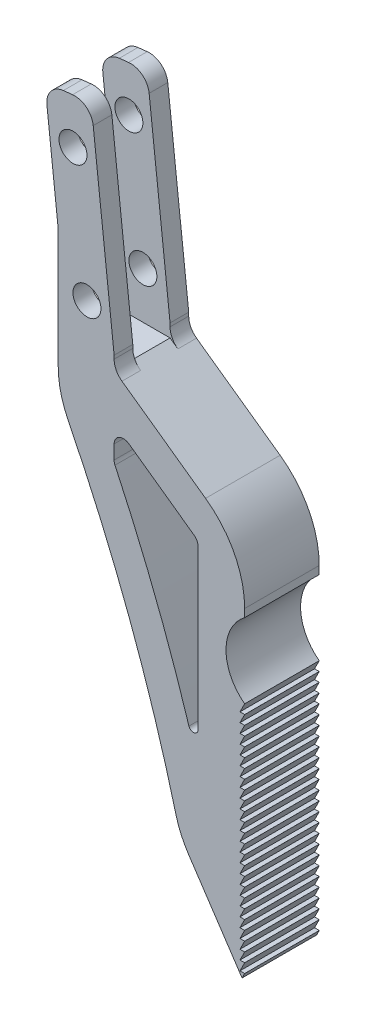
from build123d import *

# Parameters (mm, degrees)
BOSS_EXTRUDE1_DEPTH     = 4
SKETCH3_W               = 20
SKETCH3_H               = 25
CUT_EXTRUDE1_DEPTH      = 2
CUT_EXTRUDE2_DEPTH      = 78.081938119
CUT_EXTRUDE2_DEPTH_BACK = 78.081938119
CUT_EXTRUDE3_DEPTH      = 78.081938119
LPATTERN1_COUNT         = 26
LPATTERN1_PITCH         = 1.0025
CUT_EXTRUDE4_DEPTH      = 78.081938119
CUT_EXTRUDE5_DEPTH      = 78.081938119
FILLET1_R               = 10
FILLET2_R               = 2
FILLET3_R               = 1
FILLET4_R               = 0.5
SKETCH9_R               = 1.5
CUT_EXTRUDE6_DEPTH      = 77.824835617


with BuildPart() as part:
    # Sketch1 → Boss-Extrude1 (new, symmetric)
    with BuildSketch(Plane.XY):
        Polygon((0, 0), (-20, 30.005392849), (-20, 60.135392849), (-21.435566599, 73.055886204), (-16.466146078, 73.608027203), (-14.000284373, 51.414595156), (-14.000284373, 50.014595156), (0, 40.028289364), align=None)
    extrude(amount=BOSS_EXTRUDE1_DEPTH, both=True)

    # Sketch3 → Cut-Extrude1 (cut, symmetric)
    with BuildSketch(Plane.XY):
        with Locations((-24.000284373, 62.514595156)):
            Rectangle(SKETCH3_W, SKETCH3_H)
    extrude(amount=CUT_EXTRUDE1_DEPTH, both=True, mode=Mode.SUBTRACT)

    # Sketch5 → Cut-Extrude2 (cut, two sides: drawn at the far end of the back side and taken through both)
    with BuildSketch(Plane.XY.offset(4).offset(-CUT_EXTRUDE2_DEPTH_BACK)):
        with BuildLine():
            Line((91.496624596, 102.650757811), (0, 34.028289364))
            ThreePointArc((0, 34.028289364), (-2, 30.028289364), (0, 26.028289364))
            Line((0, 26.028289364), (91.496624596, -42.594179083))
            Line((91.496624596, -42.594179083), (320.238186086, -42.594179083))
            Line((320.238186086, -42.594179083), (320.238186086, 102.650757811))
            Line((320.238186086, 102.650757811), (91.496624596, 102.650757811))
        make_face()
    extrude(amount=CUT_EXTRUDE2_DEPTH + CUT_EXTRUDE2_DEPTH_BACK, mode=Mode.SUBTRACT)

    # Sketch6 → Cut-Extrude3 (cut, through all)
    with BuildSketch(Plane.XY.offset(4)):
        Polygon((0, 26.028289364), (-0.5, 25.028289364), (0, 25.028289364), align=None)
    cut_extrude3 = extrude(amount=-CUT_EXTRUDE3_DEPTH, mode=Mode.SUBTRACT)

    # LPattern1: Cut-Extrude3 ×26
    with Locations(*[(0, -i * LPATTERN1_PITCH, 0) for i in range(1, LPATTERN1_COUNT)]):
        add(cut_extrude3, mode=Mode.SUBTRACT)

    # Sketch7 → Cut-Extrude4 (cut, through all)
    with BuildSketch(Plane.XY.offset(4)):
        with BuildLine():
            Line((-20, 45.005392849), (-20, 30.005392849))
            Line((-20, 30.005392849), (-6.955074875, 10.434487696))
            ThreePointArc((-6.955074875, 10.434487696), (-12.476218242, 28.097776313), (-20, 45.005392849))
        make_face()
    extrude(amount=-CUT_EXTRUDE4_DEPTH, mode=Mode.SUBTRACT)

    # Sketch8 → Cut-Extrude5 (cut, through all)
    with BuildSketch(Plane.XY.offset(4)):
        with BuildLine():
            Line((-14.004117633, 45.104021749), (-5, 38.681447059))
            Line((-5, 38.681447059), (-5, 17.744021749))
            ThreePointArc((-5, 17.744021749), (-9.031897039, 29.772645882), (-14.004117633, 41.444021749))
            Line((-14.004117633, 41.444021749), (-14.004117633, 45.104021749))
        make_face()
    extrude(amount=-CUT_EXTRUDE5_DEPTH, mode=Mode.SUBTRACT)

    # Fillet1
    fillet1_edges = [part.edges().sort_by_distance(p)[0] for p in [
        (0, 40.028289364, 0),
        (-20, 45.005392849, 0),
        (-6.955074875, 10.434487696, 0),
    ]]
    fillet(fillet1_edges, radius=FILLET1_R)

    # Fillet2
    fillet2_edges = [part.edges().sort_by_distance(p)[0] for p in [
        (-21.435566599, 73.055886204, 3),
        (-16.466146078, 73.608027203, 3),
        (-14.000284373, 50.014595156, 3),
        (-21.435566599, 73.055886204, -3),
        (-16.466146078, 73.608027203, -3),
        (-14.000284373, 50.014595156, -3),
    ]]
    fillet(fillet2_edges, radius=FILLET2_R)

    # Fillet3
    fillet3_edges = [part.edges().sort_by_distance(p)[0] for p in [
        (-14.004117633, 41.444021749, 0),
        (-14.004117633, 45.104021749, 0),
        (-5, 38.681447059, 0),
    ]]
    fillet(fillet3_edges, radius=FILLET3_R)

    # Fillet4
    fillet4_edges = [part.edges().sort_by_distance(p)[0] for p in [
        (-5, 17.744021749, 0),
    ]]
    fillet(fillet4_edges, radius=FILLET4_R)

    # Sketch9 → Cut-Extrude6 (cut, through all)
    with BuildSketch(Plane.XY.offset(4)):
        with Locations((-18.416383851, 68.521557639)):
            Circle(SKETCH9_R)
        with Locations((-16.915664614, 55.014672662)):
            Circle(SKETCH9_R)
    extrude(amount=-CUT_EXTRUDE6_DEPTH, mode=Mode.SUBTRACT)


solid = part.part
